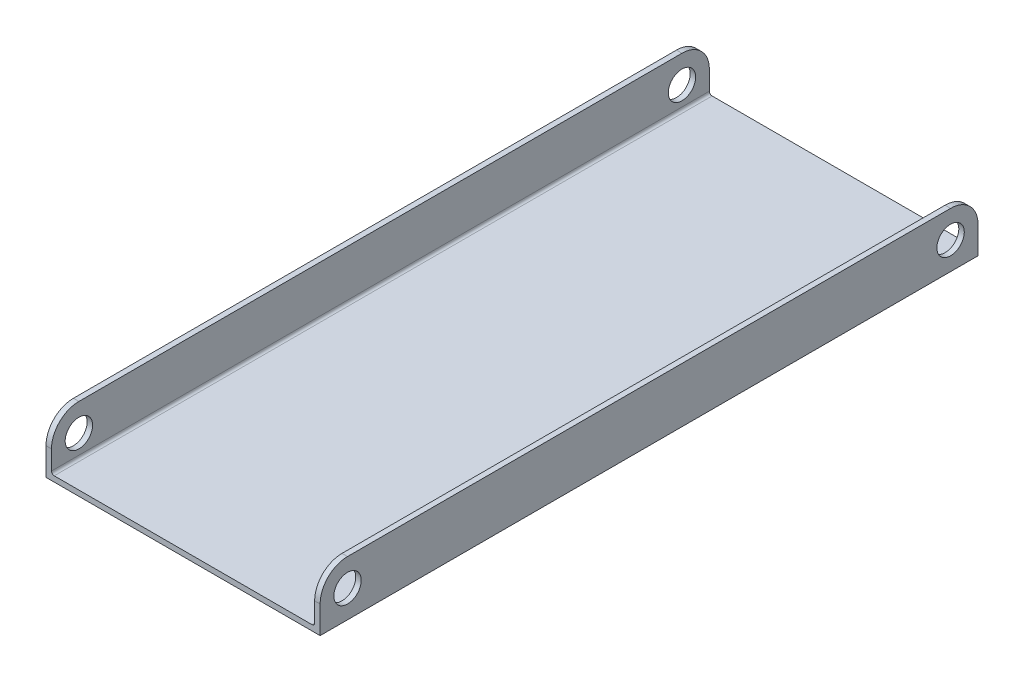
from build123d import *

# Parameters (mm, degrees)
BOSS_EXTRUDE1_DEPTH = 152.4
FILLET1_R           = 0.635
FILLET2_R           = 6.35
SKETCH3_R           = 3.175
CUT_EXTRUDE1_DEPTH  = 166.587741092


with BuildPart() as part:
    # Sketch2 → Boss-Extrude1 (new body)
    with BuildSketch(Plane.XY):
        Polygon((31.75, 0), (31.75, 1.27), (1.27, 1.27), (1.27, 12.7), (0, 12.7), (0, 0), align=None)
        Polygon((62.23, 1.27), (31.75, 1.27), (31.75, 0), (63.5, 0), (63.5, 12.7), (62.23, 12.7), align=None)
    extrude(amount=-BOSS_EXTRUDE1_DEPTH)

    # Fillet1
    fillet1_edges = [part.edges().sort_by_distance(p)[0] for p in [
        (1.27, 1.27, -76.2),
        (62.23, 1.27, -76.2),
    ]]
    fillet(fillet1_edges, radius=FILLET1_R)

    # Fillet2
    fillet2_edges = [part.edges().sort_by_distance(p)[0] for p in [
        (0.635, 12.7, 0),
        (62.865, 12.7, 0),
        (62.865, 12.7, -152.4),
        (0.635, 12.7, -152.4),
    ]]
    fillet(fillet2_edges, radius=FILLET2_R)

    # Sketch3 → Cut-Extrude1 (cut, through all)
    with BuildSketch(Plane(origin=(63.5, 0, 0), x_dir=(0, 0, -1), z_dir=(1, 0, 0))):
        with Locations((6.35, 6.35)):
            Circle(SKETCH3_R)
        with Locations((146.05, 6.35)):
            Circle(SKETCH3_R)
    extrude(amount=-CUT_EXTRUDE1_DEPTH, mode=Mode.SUBTRACT)


solid = part.part
